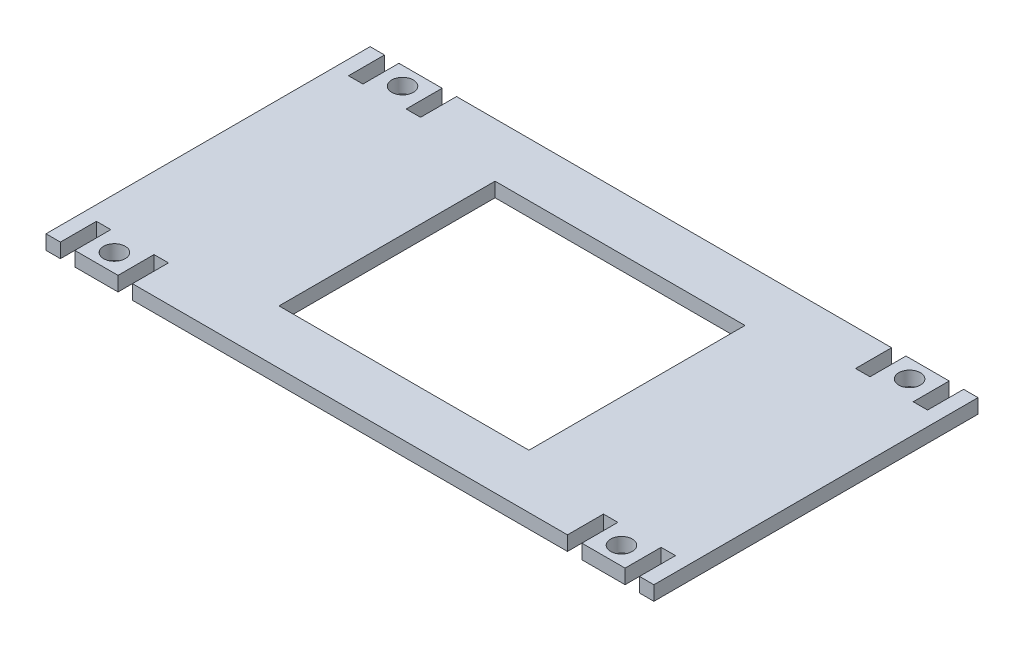
from build123d import *

# Parameters (mm, degrees)
SKETCH1_R           = 1.5
BOSS_EXTRUDE1_DEPTH = 2
SKETCH2_W           = 34.7
SKETCH2_H           = 30
CUT_EXTRUDE1_DEPTH  = 10


with BuildPart() as part:
    # Sketch1 → Boss-Extrude1 (new body)
    with BuildSketch(Plane(origin=(0, 0, 0), x_dir=(1, 0, 0), z_dir=(0, 1, 0))):
        Polygon((0, 0), (2, 0), (2, 5), (4, 5), (4, 0), (10, 0), (10, 5), (12, 5), (12, 0), (72.4, 0), (72.4, 5), (74.4, 5), (74.4, 0), (80.4, 0), (80.4, 5), (82.4, 5), (82.4, 0), (84.4, 0), (84.4, 45), (82.4, 45), (82.4, 40), (80.4, 40), (80.4, 45), (74.4, 45), (74.4, 40), (72.4, 40), (72.4, 45), (12, 45), (12, 40), (10, 40), (10, 45), (4, 45), (4, 40), (2, 40), (2, 45), (0, 45), align=None)
        with Locations(Location((7, 42.5, 0), (0, 0, 270))):
            Circle(SKETCH1_R, mode=Mode.SUBTRACT)
        with Locations(Location((77.4, 42.5, 0), (0, 0, 90))):
            Circle(SKETCH1_R, mode=Mode.SUBTRACT)
        with Locations(Location((7, 2.5, 0), (0, 0, 90))):
            Circle(SKETCH1_R, mode=Mode.SUBTRACT)
        with Locations(Location((77.4, 2.5, 0), (0, 0, 270))):
            Circle(SKETCH1_R, mode=Mode.SUBTRACT)
    extrude(amount=BOSS_EXTRUDE1_DEPTH)

    # Sketch2 → Cut-Extrude1 (cut)
    with BuildSketch(Plane(origin=(0, 2, 0), x_dir=(1, 0, 0), z_dir=(0, 1, 0))):
        with Locations((42.2, 22.5)):
            Rectangle(SKETCH2_W, SKETCH2_H)
    extrude(amount=-CUT_EXTRUDE1_DEPTH, mode=Mode.SUBTRACT)


solid = part.part
